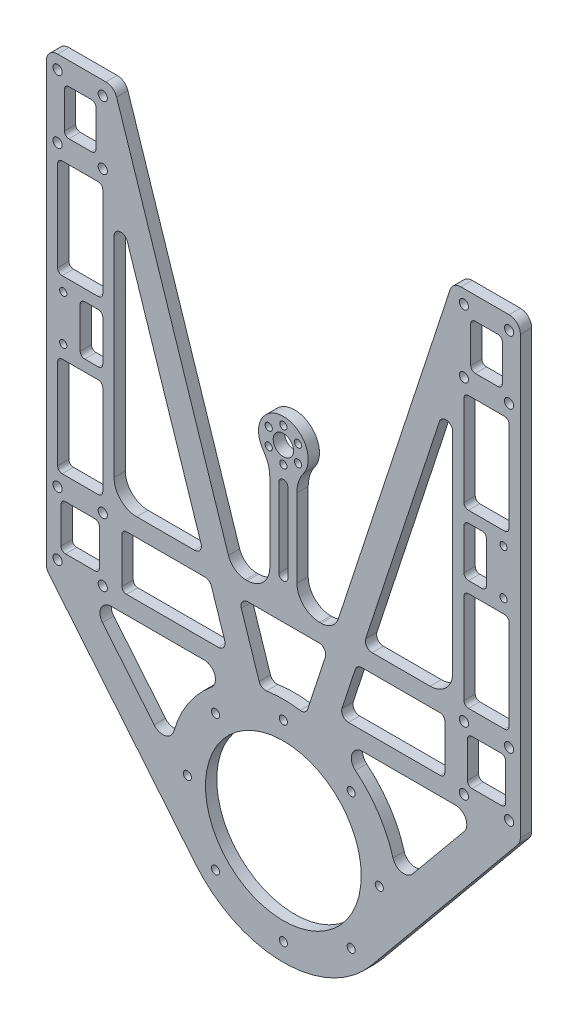
from build123d import *

# Parameters (mm, degrees)
SKETCH_2_W           = 30
SKETCH_2_H           = 160
SKETCH_2_R           = 1.6
SKETCH_2_H_2         = 40
SKETCH_2_W_2         = 150
EXTRUDE_1_DEPTH      = 5
FILLET_4_R           = 10
SKETCH_10_R          = 1.6
EXTRUDE_5_DEPTH      = 5
FILLET_6_R           = 15
FILLET_7_R           = 10
CUT_EXTRUDE_4_DEPTH  = 25
CUT_EXTRUDE_START    = -10
SKETCH_18_R          = 4.5
CUT_EXTRUDE_8_DEPTH  = 10
SKETCH_19_R          = 1.8
SKETCH_19_R_2        = 34.5
EXTRUDE_6_DEPTH      = 5
SKETCH_20_R          = 2.05
CUT_EXTRUDE_9_DEPTH  = 10
SKETCH_22_W          = 20
SKETCH_22_H          = 44
SKETCH_22_W_2        = 10
SKETCH_22_H_2        = 22
SKETCH_22_W_3        = 14
SKETCH_22_H_3        = 20
SKETCH_22_W_4        = 17
CUT_EXTRUDE_10_DEPTH = 10
FILLET_8_R           = 2
CUT_EXTRUDE_11_DEPTH = 10
FILLET_9_R           = 5
SKETCH_24_W          = 65.5
SKETCH_24_H          = 24
CUT_EXTRUDE_12_DEPTH = 10
FILLET_10_R          = 2
EXTRUDE_START        = -5
EXTRUDE_7_DEPTH      = 5
FILLET_11_R          = 3
CUT_EXTRUDE_13_DEPTH = 10
FILLET_13_R          = 3
FILLET_14_R          = 8
FILLET_15_R          = 5


with BuildPart() as part:
    # 草图2 → 凸台-拉伸1 (new body)
    # profile 1 of 5: a face of its own
    with BuildSketch(Plane.XY):
        with Locations((-90, 100)):
            Rectangle(SKETCH_2_W, SKETCH_2_H)
        with Locations((-97.5, 70)):
            Circle(SKETCH_2_R, mode=Mode.SUBTRACT)
        with Locations((-97.5, 90)):
            Circle(SKETCH_2_R, mode=Mode.SUBTRACT)
    # profile 2 of 5: a face of its own
    with BuildSketch(Plane.XY):
        with Locations((-90, 0)):
            Rectangle(SKETCH_2_W, SKETCH_2_H_2)
    # profile 3 of 5: a face of its own
    with BuildSketch(Plane.XY):
        Rectangle(SKETCH_2_W_2, SKETCH_2_H_2)
    # profile 4 of 5: a face of its own
    with BuildSketch(Plane.XY):
        with Locations((90, 0)):
            Rectangle(SKETCH_2_W, SKETCH_2_H_2)
    # profile 5 of 5: a face of its own
    with BuildSketch(Plane.XY):
        with Locations((90, 100)):
            Rectangle(SKETCH_2_W, SKETCH_2_H)
        with Locations((97.5, 70)):
            Circle(SKETCH_2_R, mode=Mode.SUBTRACT)
        with Locations((97.5, 90)):
            Circle(SKETCH_2_R, mode=Mode.SUBTRACT)
    extrude(amount=EXTRUDE_1_DEPTH)

    # 圆角4
    fillet_4_edges = [part.edges().sort_by_distance(p)[0] for p in [
        (-75, 20, 2.5),
        (75, 20, 2.5),
    ]]
    fillet(fillet_4_edges, radius=FILLET_4_R)

    # 草图10 → 凸台-拉伸5 (add)
    with BuildSketch(Plane.XY.offset(5)):
        with BuildLine():
            Line((-6, 70.780455543), (-6, 20))
            Line((-6, 20), (6, 20))
            Line((6, 20), (6, 70.780455543))
            ThreePointArc((6, 70.780455543), (0, 91), (-6, 70.780455543))
        make_face()
        with Locations((-6.495190528, 76.25)):
            Circle(SKETCH_10_R, mode=Mode.SUBTRACT)
        with Locations((-6.495190528, 83.75)):
            Circle(SKETCH_10_R, mode=Mode.SUBTRACT)
        with BuildLine():
            ThreePointArc((3.354101966, 83), (0, 75.5), (-3.354101966, 83))
            Line((-3.354101966, 83), (3.354101966, 83))
        make_face(mode=Mode.SUBTRACT)
        with Locations((6.495190528, 83.75)):
            Circle(SKETCH_10_R, mode=Mode.SUBTRACT)
        with Locations((6.495190528, 76.25)):
            Circle(SKETCH_10_R, mode=Mode.SUBTRACT)
        with Locations((0, 72.5)):
            Circle(SKETCH_10_R, mode=Mode.SUBTRACT)
        with Locations((0, 87.5)):
            Circle(SKETCH_10_R, mode=Mode.SUBTRACT)
    extrude(amount=-EXTRUDE_5_DEPTH)

    # 圆角6
    fillet_6_edges = [part.edges().sort_by_distance(p)[0] for p in [
        (6, 70.780455543, 2.5),
        (-6, 70.780455543, 2.5),
    ]]
    fillet(fillet_6_edges, radius=FILLET_6_R)

    # 圆角7
    fillet_7_edges = [part.edges().sort_by_distance(p)[0] for p in [
        (-6, 20, 2.5),
        (6, 20, 2.5),
    ]]
    fillet(fillet_7_edges, radius=FILLET_7_R)

    # 草图11 → 切除-拉伸4 (cut)
    with BuildSketch(Plane.XY.offset(5)):
        with BuildLine():
            Line((2, 64.835145142), (2, 29.835145142))
            ThreePointArc((2, 29.835145142), (0, 27.835145142), (-2, 29.835145142))
            Line((-2, 29.835145142), (-2, 64.835145142))
            ThreePointArc((-2, 64.835145142), (0, 66.835145142), (2, 64.835145142))
        make_face()
    extrude(amount=-CUT_EXTRUDE_4_DEPTH, mode=Mode.SUBTRACT)

    # 草图18 → 切除-拉伸8 (cut)
    with BuildSketch(Plane(origin=(0, 0, 0), x_dir=(-1, 0, 0), z_dir=(0, 0, -1)).offset(CUT_EXTRUDE_START)):
        with Locations(Location((0, 80, 0), (0, 0, 180))):
            Circle(SKETCH_18_R)
    extrude(amount=CUT_EXTRUDE_8_DEPTH, mode=Mode.SUBTRACT)

    # 草图19 → 凸台-拉伸6 (add)
    # profile 1 of 3: a face of its own
    with BuildSketch(Plane.XY.offset(5)):
        with BuildLine():
            Line((-15.692354826, -20), (-105, -20))
            Line((-105, -20), (-38.970498149, -100.117756367))
            ThreePointArc((-38.970498149, -100.117756367), (-48.494541911, -53.909953696), (-15.692354826, -20))
        make_face()
    # profile 2 of 3: a face of its own
    with BuildSketch(Plane.XY.offset(5)):
        with BuildLine():
            ThreePointArc((-15.692354826, -20), (-48.494541911, -53.909953696), (-38.970498149, -100.117756367))
            ThreePointArc((-38.970498149, -100.117756367), (0, -118.5), (38.970498149, -100.117756367))
            ThreePointArc((38.970498149, -100.117756367), (48.494541911, -53.909953696), (15.692354826, -20))
            Line((15.692354826, -20), (-15.692354826, -20))
        make_face()
        with Locations((-30.0520382, -98.0520382)):
            Circle(SKETCH_19_R, mode=Mode.SUBTRACT)
        with Locations((0, -110.5)):
            Circle(SKETCH_19_R, mode=Mode.SUBTRACT)
        with Locations((30.0520382, -98.0520382)):
            Circle(SKETCH_19_R, mode=Mode.SUBTRACT)
        with Locations((-42.5, -68)):
            Circle(SKETCH_19_R, mode=Mode.SUBTRACT)
        with Locations((-30.0520382, -37.9479618)):
            Circle(SKETCH_19_R, mode=Mode.SUBTRACT)
        with Locations((0, -68)):
            Circle(SKETCH_19_R_2, mode=Mode.SUBTRACT)
        with Locations((42.5, -68)):
            Circle(SKETCH_19_R, mode=Mode.SUBTRACT)
        with Locations((30.0520382, -37.9479618)):
            Circle(SKETCH_19_R, mode=Mode.SUBTRACT)
        with Locations((0, -25.5)):
            Circle(SKETCH_19_R, mode=Mode.SUBTRACT)
    # profile 3 of 3: a face of its own
    with BuildSketch(Plane.XY.offset(5)):
        with BuildLine():
            ThreePointArc((15.692354826, -20), (48.494541911, -53.909953696), (38.970498149, -100.117756367))
            Line((38.970498149, -100.117756367), (105, -20))
            Line((105, -20), (15.692354826, -20))
        make_face()
    extrude(amount=-EXTRUDE_6_DEPTH)

    # 草图20 → 切除-拉伸9 (cut)
    with BuildSketch(Plane.XY.offset(5)):
        with Locations((100, -14)):
            Circle(SKETCH_20_R)
        with Locations((80, 14)):
            Circle(SKETCH_20_R)
        with Locations((100, 14)):
            Circle(SKETCH_20_R)
        with Locations((80, -14)):
            Circle(SKETCH_20_R)
        with Locations((80, 174)):
            Circle(SKETCH_20_R)
        with Locations((100, 174)):
            Circle(SKETCH_20_R)
        with Locations((100, 146)):
            Circle(SKETCH_20_R)
        with Locations((80, 146)):
            Circle(SKETCH_20_R)
        with Locations((-80, 146)):
            Circle(SKETCH_20_R)
        with Locations((-100, 146)):
            Circle(SKETCH_20_R)
        with Locations((-100, 174)):
            Circle(SKETCH_20_R)
        with Locations((-80, 174)):
            Circle(SKETCH_20_R)
        with Locations((-80, -14)):
            Circle(SKETCH_20_R)
        with Locations((-100, 14)):
            Circle(SKETCH_20_R)
        with Locations((-80, 14)):
            Circle(SKETCH_20_R)
        with Locations((-100, -14)):
            Circle(SKETCH_20_R)
    extrude(amount=-CUT_EXTRUDE_9_DEPTH, mode=Mode.SUBTRACT)

    # 草图22 → 切除-拉伸10 (cut)
    with BuildSketch(Plane.XY.offset(5)):
        with Locations((-90, 42)):
            Rectangle(SKETCH_22_W, SKETCH_22_H)
        with Locations((-85, 80)):
            Rectangle(SKETCH_22_W_2, SKETCH_22_H_2)
        with Locations((-90, 118)):
            Rectangle(SKETCH_22_W, SKETCH_22_H)
        with Locations((-90, 160)):
            Rectangle(SKETCH_22_W_3, SKETCH_22_H_3)
        with Locations((-90, 0)):
            Rectangle(SKETCH_22_W_4, SKETCH_22_H_3)
        with Locations((90, 0)):
            Rectangle(SKETCH_22_W_4, SKETCH_22_H_3)
        with Locations((90, 160)):
            Rectangle(SKETCH_22_W_3, SKETCH_22_H_3)
        with Locations((90, 118)):
            Rectangle(SKETCH_22_W, SKETCH_22_H)
        with Locations((85, 80)):
            Rectangle(SKETCH_22_W_2, SKETCH_22_H_2)
        with Locations((90, 42)):
            Rectangle(SKETCH_22_W, SKETCH_22_H)
    extrude(amount=-CUT_EXTRUDE_10_DEPTH, mode=Mode.SUBTRACT)

    # 圆角8
    fillet_8_edges = [part.edges().sort_by_distance(p)[0] for p in [
        (-83, 170, 2.5),
        (-83, 150, 2.5),
        (-97, 150, 2.5),
        (-97, 170, 2.5),
        (-81.5, 10, 2.5),
        (-81.5, -10, 2.5),
        (-98.5, -10, 2.5),
        (-98.5, 10, 2.5),
        (-80, 140, 2.5),
        (-80, 96, 2.5),
        (-100, 96, 2.5),
        (-100, 140, 2.5),
        (-80, 91, 2.5),
        (-80, 69, 2.5),
        (-90, 69, 2.5),
        (-90, 91, 2.5),
        (90, 91, 2.5),
        (90, 69, 2.5),
        (80, 69, 2.5),
        (80, 91, 2.5),
        (100, 140, 2.5),
        (100, 96, 2.5),
        (80, 96, 2.5),
        (80, 140, 2.5),
        (97, 170, 2.5),
        (97, 150, 2.5),
        (83, 150, 2.5),
        (83, 170, 2.5),
        (98.5, 10, 2.5),
        (98.5, -10, 2.5),
        (81.5, -10, 2.5),
        (81.5, 10, 2.5),
        (100, 64, 2.5),
        (100, 20, 2.5),
        (80, 20, 2.5),
        (80, 64, 2.5),
        (-80, 64, 2.5),
        (-80, 20, 2.5),
        (-100, 20, 2.5),
        (-100, 64, 2.5),
    ]]
    fillet(fillet_8_edges, radius=FILLET_8_R)

    # 草图23 → 切除-拉伸11 (cut)
    with BuildSketch(Plane.XY.offset(5)):
        with BuildLine():
            Line((-15.692354826, -20), (-86.85807127, -20))
            Line((-86.85807127, -20), (-50.362936202, -64.281847627))
            ThreePointArc((-50.362936202, -64.281847627), (-39.76236758, -36.867956629), (-15.692354826, -20))
        make_face()
        with BuildLine():
            Line((86.85807127, -20), (15.692354826, -20))
            ThreePointArc((15.692354826, -20), (39.76236758, -36.867956629), (50.362936202, -64.281847627))
            Line((50.362936202, -64.281847627), (86.85807127, -20))
        make_face()
    extrude(amount=-CUT_EXTRUDE_11_DEPTH, mode=Mode.SUBTRACT)

    # 圆角9
    fillet_9_edges = [part.edges().sort_by_distance(p)[0] for p in [
        (-15.692354826, -20, 2.5),
        (-50.362936202, -64.281847627, 2.5),
        (-86.85807127, -20, 2.5),
        (50.362936202, -64.281847627, 2.5),
        (15.692354826, -20, 2.5),
        (86.85807127, -20, 2.5),
    ]]
    fillet(fillet_9_edges, radius=FILLET_9_R)

    # 草图24 → 切除-拉伸12 (cut)
    with BuildSketch(Plane.XY.offset(5)):
        with Locations((-38.75, 0)):
            Rectangle(SKETCH_24_W, SKETCH_24_H)
        with Locations((38.75, 0)):
            Rectangle(SKETCH_24_W, SKETCH_24_H)
    extrude(amount=-CUT_EXTRUDE_12_DEPTH, mode=Mode.SUBTRACT)

    # 圆角10
    fillet_10_edges = [part.edges().sort_by_distance(p)[0] for p in [
        (-6, -12, 2.5),
        (-71.5, -12, 2.5),
        (-71.5, 12, 2.5),
        (-6, 12, 2.5),
        (6, -12, 2.5),
        (6, 12, 2.5),
        (71.5, 12, 2.5),
        (71.5, -12, 2.5),
    ]]
    fillet(fillet_10_edges, radius=FILLET_10_R)

    # 草图25 → 凸台-拉伸7 (add)
    with BuildSketch(Plane.XY.offset(5).offset(EXTRUDE_START)):
        Polygon((-19.916129526, 12), (-75, 180), (-75, 141.484192434), (-32.544699497, 12), align=None)
        Polygon((-12.047005172, -12), (-19.916129526, 12), (-32.544699497, 12), (-24.675575144, -12), align=None)
        with BuildLine():
            Line((-8, 12), (-19.916129526, 12))
            Line((-19.916129526, 12), (-12.047005172, -12))
            Line((-12.047005172, -12), (-8, -12))
            ThreePointArc((-8, -12), (-6.585786438, -11.414213562), (-6, -10))
            Line((-6, -10), (-6, 10))
            ThreePointArc((-6, 10), (-6.585786438, 11.414213562), (-8, 12))
        make_face()
        with BuildLine():
            Line((12.047005172, -12), (19.916129526, 12))
            Line((19.916129526, 12), (8, 12))
            ThreePointArc((8, 12), (6.585786438, 11.414213562), (6, 10))
            Line((6, 10), (6, -10))
            ThreePointArc((6, -10), (6.585786438, -11.414213562), (8, -12))
            Line((8, -12), (12.047005172, -12))
        make_face()
        Polygon((32.544699497, 12), (19.916129526, 12), (12.047005172, -12), (24.675575144, -12), align=None)
        Polygon((75, 141.484192434), (75, 180), (19.916129526, 12), (32.544699497, 12), align=None)
    extrude(amount=EXTRUDE_7_DEPTH)

    # 圆角11
    fillet_11_edges = [part.edges().sort_by_distance(p)[0] for p in [
        (-32.544699497, 12, 2.5),
        (-24.675575144, -12, 2.5),
        (-35.167740948, 20, 2.5),
        (-75, 141.484192434, 2.5),
        (35.167740948, 20, 2.5),
        (32.544699497, 12, 2.5),
        (75, 141.484192434, 2.5),
        (24.675575144, -12, 2.5),
    ]]
    fillet(fillet_11_edges, radius=FILLET_11_R)

    # 草图26 → 切除-拉伸13 (cut)
    with BuildSketch(Plane.XY.offset(5)):
        with BuildLine():
            Line((-19.916129526, 12), (19.916129526, 12))
            Line((19.916129526, 12), (9.920995611, -18.484105117))
            ThreePointArc((9.920995611, -18.484105117), (0, -17.5), (-9.920995611, -18.484105117))
            Line((-9.920995611, -18.484105117), (-19.916129526, 12))
        make_face()
    extrude(amount=-CUT_EXTRUDE_13_DEPTH, mode=Mode.SUBTRACT)

    # 圆角13
    fillet_13_edges = [part.edges().sort_by_distance(p)[0] for p in [
        (-19.916129526, 12, 2.5),
        (19.916129526, 12, 2.5),
        (9.920995611, -18.484105117, 2.5),
        (-9.920995611, -18.484105117, 2.5),
    ]]
    fillet(fillet_13_edges, radius=FILLET_13_R)

    # 圆角14
    fillet_14_edges = [part.edges().sort_by_distance(p)[0] for p in [
        (-22.539170977, 20, 2.5),
        (22.539170977, 20, 2.5),
    ]]
    fillet(fillet_14_edges, radius=FILLET_14_R)

    # 圆角15
    fillet_15_edges = [part.edges().sort_by_distance(p)[0] for p in [
        (-105, 180, 2.5),
        (-75, 180, 2.5),
        (75, 180, 2.5),
        (105, 180, 2.5),
        (105, -20, 2.5),
        (-105, -20, 2.5),
    ]]
    fillet(fillet_15_edges, radius=FILLET_15_R)


solid = part.part
